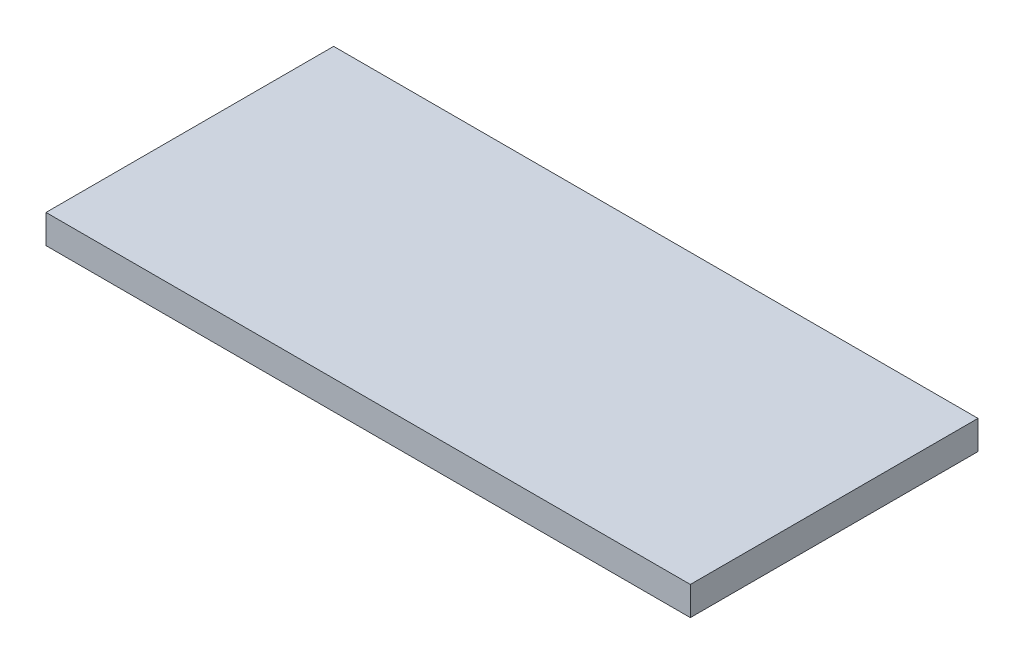
from build123d import *

# Parameters (mm, degrees)
SKETCH1_W           = 35.56
SKETCH1_H           = 15.875
BOSS_EXTRUDE1_DEPTH = 1.5875


with BuildPart() as part:
    # Sketch1 → Boss-Extrude1 (new body)
    with BuildSketch(Plane(origin=(0, 0, 0), x_dir=(1, 0, 0), z_dir=(0, 1, 0))):
        Rectangle(SKETCH1_W, SKETCH1_H)
    extrude(amount=BOSS_EXTRUDE1_DEPTH)


solid = part.part
